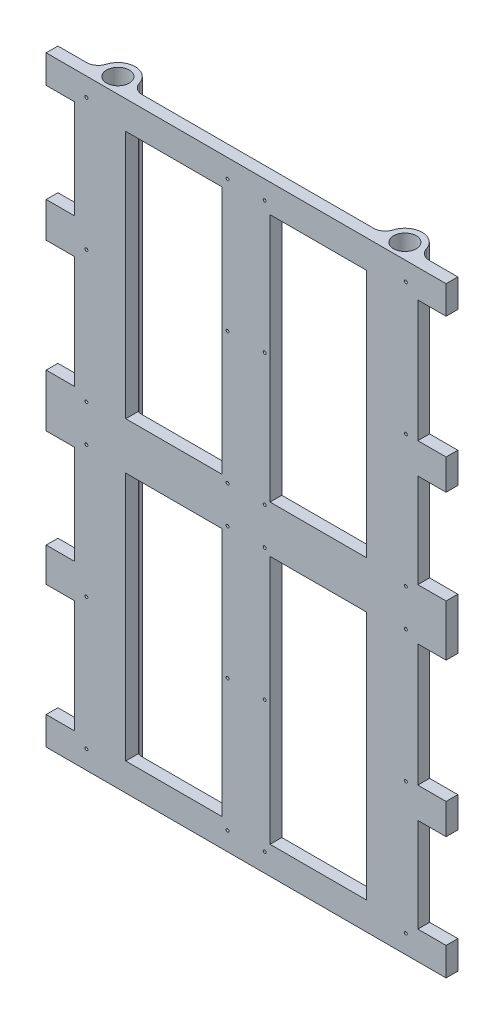
from build123d import *

# Parameters (mm, degrees)
SKETCH1_R                    = 4.825
BOSS_EXTRUDE1_DEPTH          = 255.6
CUT_EXTRUDE2_DEPTH           = 270.507403655
CUT_EXTRUDE2_DEPTH_BACK      = 270.507403655
SKETCH2_W                    = 41
SKETCH2_H                    = 106
SKETCH2_H_2                  = 105.8
SKETCH2_W_2                  = 20
SKETCH2_H_3                  = 40
SKETCH2_H_4                  = 51.8
SKETCH2_H_5                  = 52
SKETCH2_H_6                  = 42
SKETCH2_H_7                  = 47.8
SKETCH2_H_8                  = 47.9
F_1_25_1_25_DIAMETER_HOLE1_D = 1.25
SKETCH5_R                    = 1.5
CUT_EXTRUDE3_DEPTH           = 270.507403753


with BuildPart() as part:
    # Sketch1 → Boss-Extrude1 (new body)
    with BuildSketch(Plane(origin=(0, 0, 0), x_dir=(1, 0, 0), z_dir=(0, 1, 0))):
        with BuildLine():
            Line((85, -5), (85, 0))
            Line((85, 0), (72.817598106, 0))
            ThreePointArc((72.817598106, 0), (69.825892195, 0.993792849), (68.023440659, 3.580121704))
            ThreePointArc((68.023440659, 3.580121704), (61, 8.825), (53.976559341, 3.580121704))
            ThreePointArc((53.976559341, 3.580121704), (52.174107805, 0.993792849), (49.182401894, 0))
            Line((49.182401894, 0), (-49.182401894, 0))
            ThreePointArc((-49.182401894, 0), (-52.174107805, 0.993792849), (-53.976559341, 3.580121704))
            ThreePointArc((-53.976559341, 3.580121704), (-61, 8.825), (-68.023440659, 3.580121704))
            ThreePointArc((-68.023440659, 3.580121704), (-69.825892195, 0.993792849), (-72.817598106, 0))
            Line((-72.817598106, 0), (-85, 0))
            Line((-85, 0), (-85, -5))
            Line((-85, -5), (85, -5))
        make_face()
        with Locations(Location((-61, 1.5, 0), (0, 0, 270))):
            Circle(SKETCH1_R, mode=Mode.SUBTRACT)
        with Locations(Location((61, 1.5, 0), (0, 0, 90))):
            Circle(SKETCH1_R, mode=Mode.SUBTRACT)
    extrude(amount=BOSS_EXTRUDE1_DEPTH)

    # Sketch2 → Cut-Extrude2 (cut, two sides: drawn at the far end of the back side and taken through both)
    with BuildSketch(Plane(origin=(0, 0, 0), x_dir=(-1, 0, 0), z_dir=(0, 0, -1)).offset(-CUT_EXTRUDE2_DEPTH_BACK)):
        with Locations((-30.675, 64.8)):
            Rectangle(SKETCH2_W, SKETCH2_H)
        with Locations((-30.675, 190.7)):
            Rectangle(SKETCH2_W, SKETCH2_H_2)
        with Locations((-83, 158.8)):
            Rectangle(SKETCH2_W_2, SKETCH2_H_3)
        with Locations((30.675, 64.8)):
            Rectangle(SKETCH2_W, SKETCH2_H)
        with Locations((30.675, 190.7)):
            Rectangle(SKETCH2_W, SKETCH2_H_2)
        with Locations((-83, 32)):
            Rectangle(SKETCH2_W_2, SKETCH2_H_3)
        with Locations((-83, 217.7)):
            Rectangle(SKETCH2_W_2, SKETCH2_H_4)
        with Locations((-83, 91)):
            Rectangle(SKETCH2_W_2, SKETCH2_H_5)
        with Locations((83, 222.6)):
            Rectangle(SKETCH2_W_2, SKETCH2_H_6)
        with Locations((83, 95.4)):
            Rectangle(SKETCH2_W_2, SKETCH2_H_6)
        with Locations((83, 162.7)):
            Rectangle(SKETCH2_W_2, SKETCH2_H_7)
        with Locations((83, 35.95)):
            Rectangle(SKETCH2_W_2, SKETCH2_H_8)
    extrude(amount=CUT_EXTRUDE2_DEPTH + CUT_EXTRUDE2_DEPTH_BACK, mode=Mode.SUBTRACT)

    # Ø1.25 (1.25) Diameter Hole1 (through all)
    with Locations(Plane(origin=(0, 0, 5), x_dir=(-1, 0, 0), z_dir=(0, 0, 1))):
        with Locations((-67.9, -7.9), (-7.9, -7.9), (-7.9, -63.9), (-67.9, -63.9), (-67.9, -119.9), (-7.9, -119.9), (7.9, -119.9), (67.9, -119.9), (67.9, -63.9), (7.9, -63.9), (7.9, -7.9), (67.9, -7.9), (67.9, -247.7), (7.9, -247.7), (7.9, -191.7), (67.9, -191.7), (67.9, -135.7), (7.9, -135.7), (-7.9, -135.7), (-67.9, -135.7), (-67.9, -191.7), (-7.9, -191.7), (-7.9, -247.7), (-67.9, -247.7)):
            Hole(F_1_25_1_25_DIAMETER_HOLE1_D / 2)

    # Sketch5 → Cut-Extrude3 (cut, through all)
    with BuildSketch(Plane(origin=(0, 0, 0), x_dir=(-1, 0, 0), z_dir=(0, 0, -1))):
        with Locations(Location((-67.9, 247.7, 0), (0, 0, 265.279575875))):
            Circle(SKETCH5_R)
        with Locations((-7.9, 247.7)):
            Circle(SKETCH5_R)
        with Locations(Location((-67.9, 191.7, 0), (0, 0, 265.279575875))):
            Circle(SKETCH5_R)
        with Locations(Location((-67.9, 135.7, 0), (0, 0, 265.279575875))):
            Circle(SKETCH5_R)
        with Locations((-7.9, 135.7)):
            Circle(SKETCH5_R)
        with Locations((-7.9, 191.7)):
            Circle(SKETCH5_R)
        with Locations((-7.9, 63.9)):
            Circle(SKETCH5_R)
        with Locations((-7.9, 119.9)):
            Circle(SKETCH5_R)
        with Locations(Location((-67.9, 119.9, 0), (0, 0, 180))):
            Circle(SKETCH5_R)
        with Locations(Location((-67.9, 63.9, 0), (0, 0, 180))):
            Circle(SKETCH5_R)
        with Locations((-7.9, 7.9)):
            Circle(SKETCH5_R)
        with Locations(Location((-67.9, 7.9, 0), (0, 0, 180))):
            Circle(SKETCH5_R)
        with Locations(Location((67.9, 7.9, 0), (0, 0, 274.720424125))):
            Circle(SKETCH5_R)
        with Locations((7.9, 7.9)):
            Circle(SKETCH5_R)
        with Locations(Location((67.9, 63.9, 0), (0, 0, 274.720424125))):
            Circle(SKETCH5_R)
        with Locations(Location((67.9, 119.9, 0), (0, 0, 274.720424125))):
            Circle(SKETCH5_R)
        with Locations((7.9, 119.9)):
            Circle(SKETCH5_R)
        with Locations((7.9, 63.9)):
            Circle(SKETCH5_R)
        with Locations((7.9, 191.7)):
            Circle(SKETCH5_R)
        with Locations((7.9, 135.7)):
            Circle(SKETCH5_R)
        with Locations(Location((67.9, 135.7, 0), (0, 0, 180))):
            Circle(SKETCH5_R)
        with Locations(Location((67.9, 191.7, 0), (0, 0, 180))):
            Circle(SKETCH5_R)
        with Locations((7.9, 247.7)):
            Circle(SKETCH5_R)
        with Locations(Location((67.9, 247.7, 0), (0, 0, 180))):
            Circle(SKETCH5_R)
    extrude(amount=CUT_EXTRUDE3_DEPTH, mode=Mode.SUBTRACT)


solid = part.part
